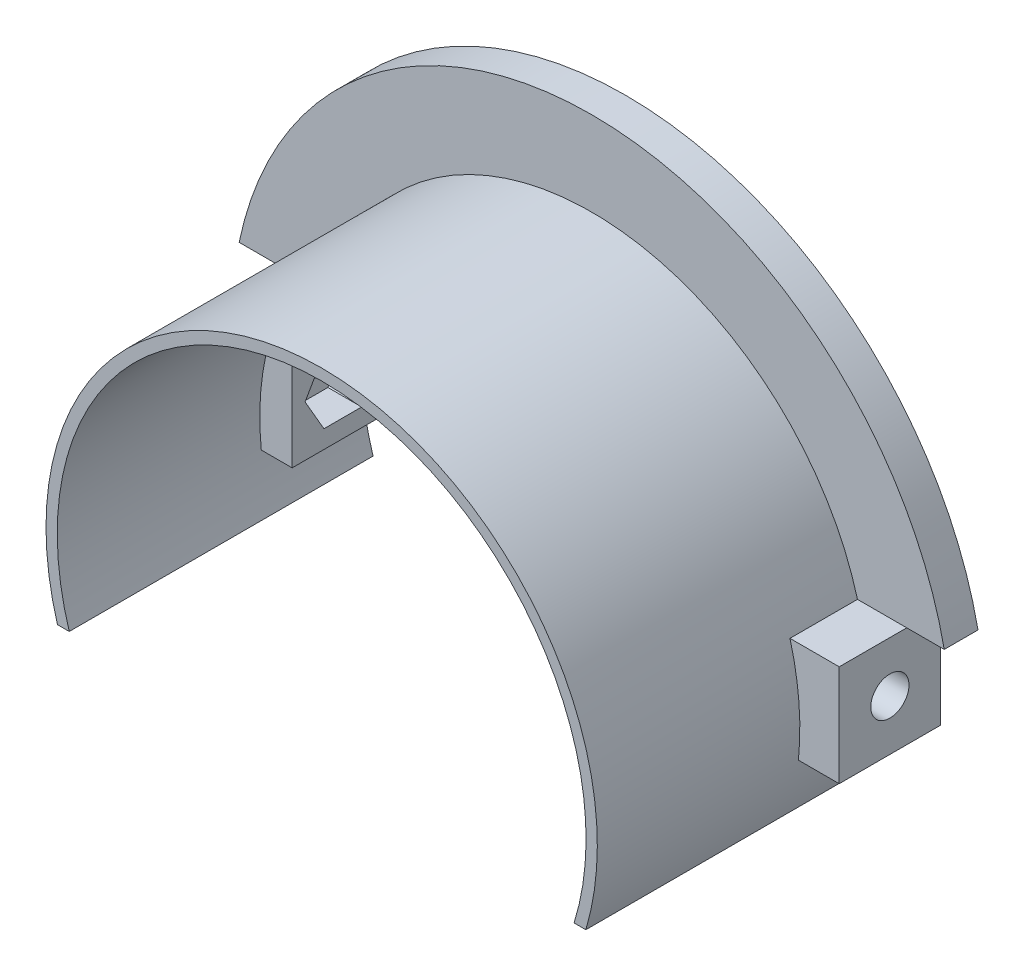
from build123d import *

# Parameters (mm, degrees)
BOSS_EXTRUDE1_DEPTH     = 9
CUT_EXTRUDE5_DEPTH      = 63
CUT_EXTRUDE5_DEPTH_BACK = 63
SKETCH7_R               = 1.7
CUT_EXTRUDE6_DEPTH      = 3
CUT_EXTRUDE3_DEPTH      = 3
BOSS_EXTRUDE3_DEPTH     = 18
BOSS_EXTRUDE4_DEPTH     = 3


with BuildPart() as part:
    # Sketch1 → Boss-Extrude1 (new body)
    with BuildSketch(Plane.XY):
        with BuildLine():
            Line((-23.621926952, 6.500351303), (-28, 6.500351303))
            Line((-28, 6.500351303), (-28, -2.499648697))
            Line((-28, -2.499648697), (-24.372151247, -2.499648697))
            ThreePointArc((-24.372151247, -2.499648697), (-24.031013525, -4.770784943), (-23.478713764, -7))
            Line((-23.478713764, -7), (-22.433234274, -7))
            ThreePointArc((-22.433234274, -7), (-23.010244201, -4.772699634), (-23.366680474, -2.499648697))
            Line((-23.366680474, -2.499648697), (-20.621926952, -2.499648697))
            Line((-20.621926952, -2.499648697), (-20.621926952, 6.500351303))
            Line((-20.621926952, 6.500351303), (-22.583078464, 6.500351303))
            ThreePointArc((-22.583078464, 6.500351303), (0, 23.5), (22.583078464, 6.500351303))
            Line((22.583078464, 6.500351303), (20.621926952, 6.500351303))
            Line((20.621926952, 6.500351303), (20.621926952, -2.499648697))
            Line((20.621926952, -2.499648697), (23.366680474, -2.499648697))
            ThreePointArc((23.366680474, -2.499648697), (23.010244201, -4.772699634), (22.433234274, -7))
            Line((22.433234274, -7), (23.478713764, -7))
            ThreePointArc((23.478713764, -7), (24.031013525, -4.770784943), (24.372151247, -2.499648697))
            Line((24.372151247, -2.499648697), (28, -2.499648697))
            Line((28, -2.499648697), (28, 6.500351303))
            Line((28, 6.500351303), (23.621926952, 6.500351303))
            ThreePointArc((23.621926952, 6.500351303), (0, 24.5), (-23.621926952, 6.500351303))
        make_face()
    extrude(amount=BOSS_EXTRUDE1_DEPTH)

    # Sketch7 → Cut-Extrude5 (cut, two sides: drawn at the far end of the back side and taken through both)
    with BuildSketch(Plane(origin=(28, 0, 0), x_dir=(0, 0, -1), z_dir=(1, 0, 0)).offset(-CUT_EXTRUDE5_DEPTH_BACK)):
        with Locations((-4.5, 2.000351303)):
            Circle(SKETCH7_R)
    extrude(amount=CUT_EXTRUDE5_DEPTH + CUT_EXTRUDE5_DEPTH_BACK, mode=Mode.SUBTRACT)

    # Sketch5 → Cut-Extrude6 (cut)
    with BuildSketch(Plane(origin=(-20.621926952, 0, 0), x_dir=(0, 0, -1), z_dir=(1, 0, 0))):
        Polygon((-6.175, 4.901536406), (-2.825, 4.901536406), (-1.15, 2.000351303), (-2.825, -0.900833799), (-6.175, -0.900833799), (-7.85, 2.000351303), align=None)
    extrude(amount=-CUT_EXTRUDE6_DEPTH, mode=Mode.SUBTRACT)

    # Sketch6 → Cut-Extrude3 (cut)
    with BuildSketch(Plane.ZY.offset(-20.621926952)):
        Polygon((2.825, 4.901536406), (6.175, 4.901536406), (7.85, 2.000351303), (6.175, -0.900833799), (2.825, -0.900833799), (1.15, 2.000351303), align=None)
    extrude(amount=-CUT_EXTRUDE3_DEPTH, mode=Mode.SUBTRACT)

    # Sketch8 → Boss-Extrude3 (add)
    with BuildSketch(Plane.XY.offset(9)):
        with BuildLine():
            ThreePointArc((-24.372151247, -2.499648697), (-24.031013525, -4.770784943), (-23.478713764, -7))
            Line((-23.478713764, -7), (-22.433234274, -7))
            ThreePointArc((-22.433234274, -7), (-23.010244201, -4.772699634), (-23.366680474, -2.499648697))
            ThreePointArc((-23.366680474, -2.499648697), (-23.411430683, 2.03836046), (-22.583078464, 6.500351303))
            ThreePointArc((-22.583078464, 6.500351303), (0, 23.5), (22.583078464, 6.500351303))
            ThreePointArc((22.583078464, 6.500351303), (23.269640564, 3.282350993), (23.5, 0))
            ThreePointArc((23.5, 0), (23.466646449, -1.251600745), (23.366680474, -2.499648697))
            ThreePointArc((23.366680474, -2.499648697), (23.010244201, -4.772699634), (22.433234274, -7))
            Line((22.433234274, -7), (23.478713764, -7))
            ThreePointArc((23.478713764, -7), (24.031013525, -4.770784943), (24.372151247, -2.499648697))
            ThreePointArc((24.372151247, -2.499648697), (24.468016936, -1.251458041), (24.5, 0))
            ThreePointArc((24.5, 0), (24.279489393, 3.279694321), (23.621926952, 6.500351303))
            ThreePointArc((23.621926952, 6.500351303), (0, 24.5), (-23.621926952, 6.500351303))
            ThreePointArc((-23.621926952, 6.500351303), (-24.415320713, 2.035218529), (-24.372151247, -2.499648697))
        make_face()
    extrude(amount=BOSS_EXTRUDE3_DEPTH)


with BuildPart() as body_2:
    # Sketch9 → Boss-Extrude4 (new body)
    with BuildSketch(Plane(origin=(0, 0, 0), x_dir=(-1, 0, 0), z_dir=(0, 0, -1))):
        with BuildLine():
            Line((-31.332817188, 6.500351303), (-28, 6.500351303))
            Line((-28, 6.500351303), (-23.621926952, 6.500351303))
            ThreePointArc((-23.621926952, 6.500351303), (0, 24.5), (23.621926952, 6.500351303))
            Line((23.621926952, 6.500351303), (28, 6.500351303))
            Line((28, 6.500351303), (31.332817188, 6.500351303))
            ThreePointArc((31.332817188, 6.500351303), (0, 32), (-31.332817188, 6.500351303))
        make_face()
    extrude(amount=-BOSS_EXTRUDE4_DEPTH)


solid = Compound([part.part, body_2.part])
